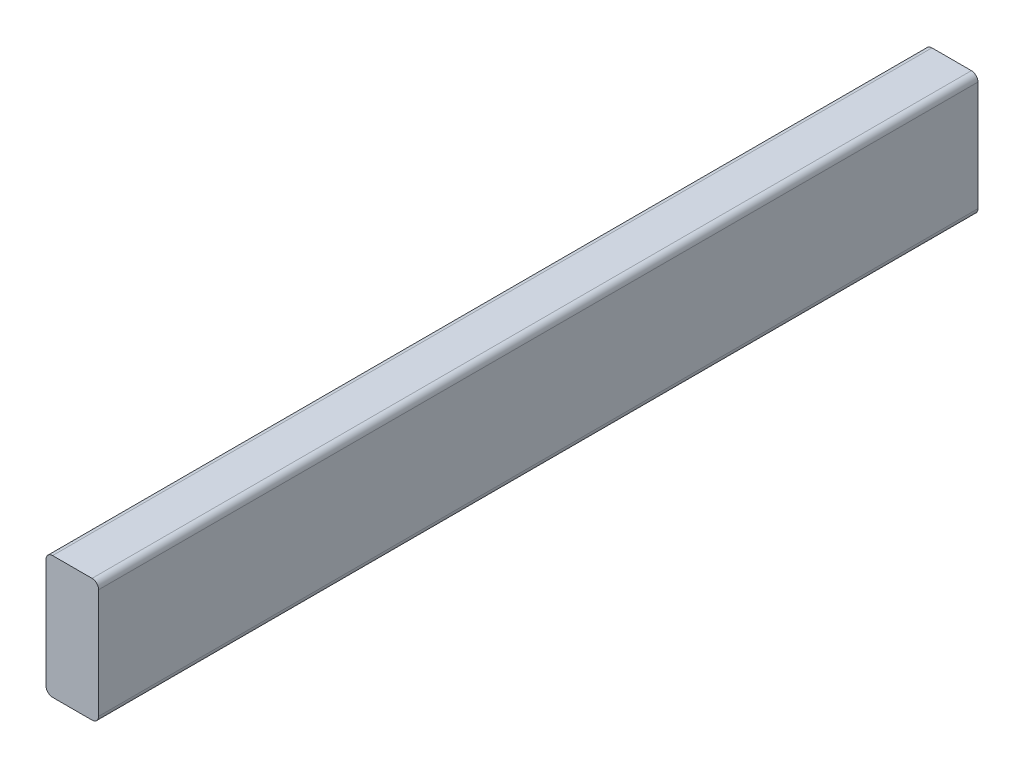
from build123d import *

# Parameters (mm, degrees)
SKETCH1_W           = 38.1
SKETCH1_H           = 88.9
BOSS_EXTRUDE1_DEPTH = 636.669208072
FILLET1_R           = 4.7625


with BuildPart() as part:
    # Sketch1 → Boss-Extrude1 (new body)
    with BuildSketch(Plane.XY):
        with Locations((-800.780594651, 56.35625)):
            Rectangle(SKETCH1_W, SKETCH1_H)
    extrude(amount=-BOSS_EXTRUDE1_DEPTH)

    # Fillet1
    fillet1_edges = [part.edges().sort_by_distance(p)[0] for p in [
        (-819.830594651, 11.90625, -318.334604036),
        (-819.830594651, 100.80625, -318.334604036),
        (-781.730594651, 100.80625, -318.334604036),
        (-781.730594651, 11.90625, -318.334604036),
    ]]
    fillet(fillet1_edges, radius=FILLET1_R)


solid = part.part
